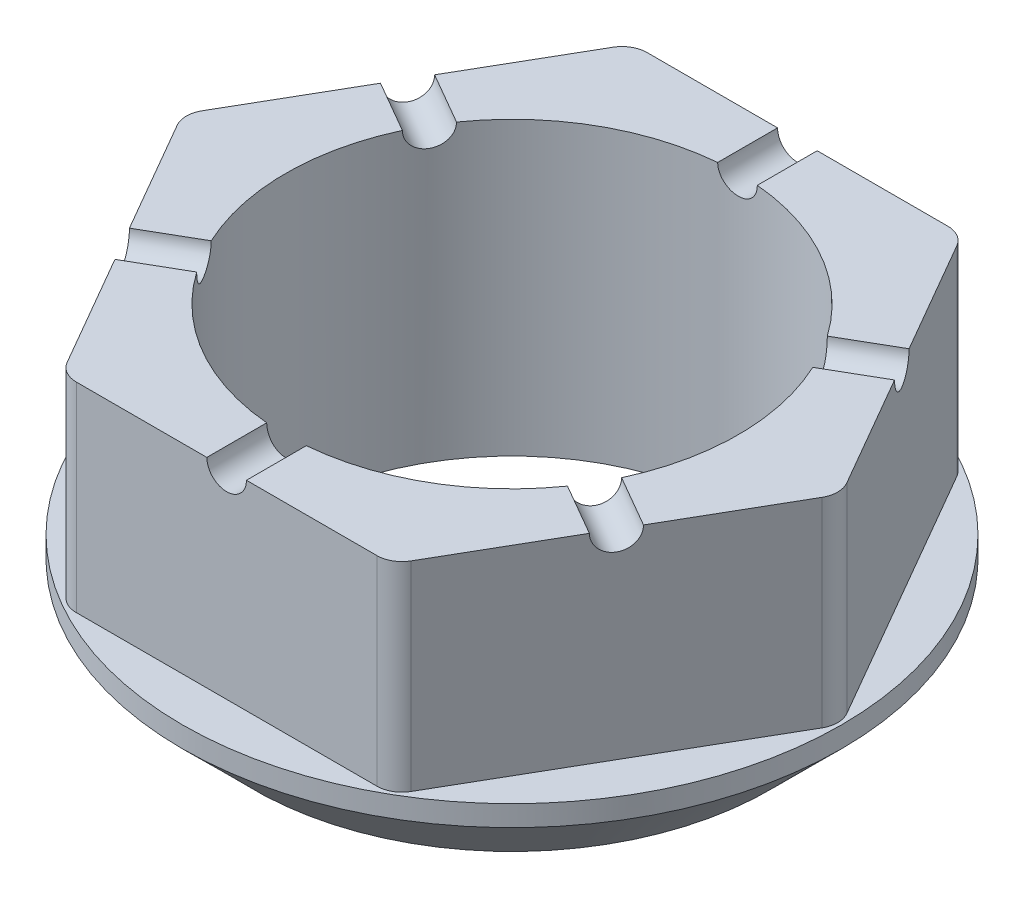
from build123d import *

# Parameters (mm, degrees)
CUT_EXTRUDE5_START = -20
CUT_EXTRUDE5_DEPTH = 20
FILLET4_R          = 2.5
CUT_EXTRUDE6_START = -84.635391772
SKETCH7_R          = 1.984375
CUT_EXTRUDE6_DEPTH = 140.691945543
CIRPATTERN2_COUNT  = 6


with BuildPart() as part:
    # Sketch1 → Revolve1 (revolve)
    with BuildSketch(Plane(origin=(0, 0, 0), x_dir=(0, 0, -1), z_dir=(1, 0, 0)), mode=Mode.PRIVATE) as revolve1_sk:
        Polygon((-22.6695, -29.21), (-22.6695, 0), (-33, 0), (-33, -22.079433914), (-25.8445, -29.21), align=None)
    revolve(revolve1_sk.sketch.rotate(Axis((0, 0, 0), (0, 1, 0)), 180), axis=Axis((0, 0, 0), (0, 1, 0)))

    # Sketch4 → Cut-Extrude5 (cut)
    with BuildSketch(Plane(origin=(0, 0, 0), x_dir=(1, 0, 0), z_dir=(0, 1, 0)).offset(CUT_EXTRUDE5_START)):
        with BuildLine():
            ThreePointArc((33, 0), (28.578838325, 16.5), (16.5, 28.578838325))
            Line((16.5, 28.578838325), (33, 0))
        make_face()
        with BuildLine():
            Line((-16.5, 28.578838325), (16.5, 28.578838325))
            ThreePointArc((16.5, 28.578838325), (0, 33), (-16.5, 28.578838325))
        make_face()
        with BuildLine():
            Line((-33, 0), (-16.5, 28.578838325))
            ThreePointArc((-16.5, 28.578838325), (-28.578838325, 16.5), (-33, 0))
        make_face()
        with BuildLine():
            ThreePointArc((16.5, -28.578838325), (28.578838325, -16.5), (33, 0))
            Line((33, 0), (16.5, -28.578838325))
        make_face()
        with BuildLine():
            Line((-16.5, -28.578838325), (-33, 0))
            ThreePointArc((-33, 0), (-28.578838325, -16.5), (-16.5, -28.578838325))
        make_face()
        with BuildLine():
            ThreePointArc((-16.5, -28.578838325), (0, -33), (16.5, -28.578838325))
            Line((16.5, -28.578838325), (-16.5, -28.578838325))
        make_face()
    extrude(amount=CUT_EXTRUDE5_DEPTH, mode=Mode.SUBTRACT)

    # Fillet4
    fillet4_edges = [part.edges().sort_by_distance(p)[0] for p in [
        (33, -10, 0),
        (16.5, -10, -28.578838325),
        (-33, -10, 0),
        (16.5, -10, 28.578838325),
        (-16.5, -10, -28.578838325),
        (-16.5, -10, 28.578838325),
    ]]
    fillet(fillet4_edges, radius=FILLET4_R)

    # Sketch7 → Cut-Extrude6 (cut)
    with BuildSketch(Plane.XY.offset(CUT_EXTRUDE6_START)):
        Circle(SKETCH7_R)
    cut_extrude6 = extrude(amount=CUT_EXTRUDE6_DEPTH, mode=Mode.SUBTRACT)

    # CirPattern2: Cut-Extrude6 ×6 about axis
    cirpattern2_axis = Axis((0, 0, 0), (0, -1, 0))
    for i in range(1, CIRPATTERN2_COUNT):
        add(cut_extrude6.rotate(cirpattern2_axis, i * 360 / CIRPATTERN2_COUNT), mode=Mode.SUBTRACT)


solid = part.part
